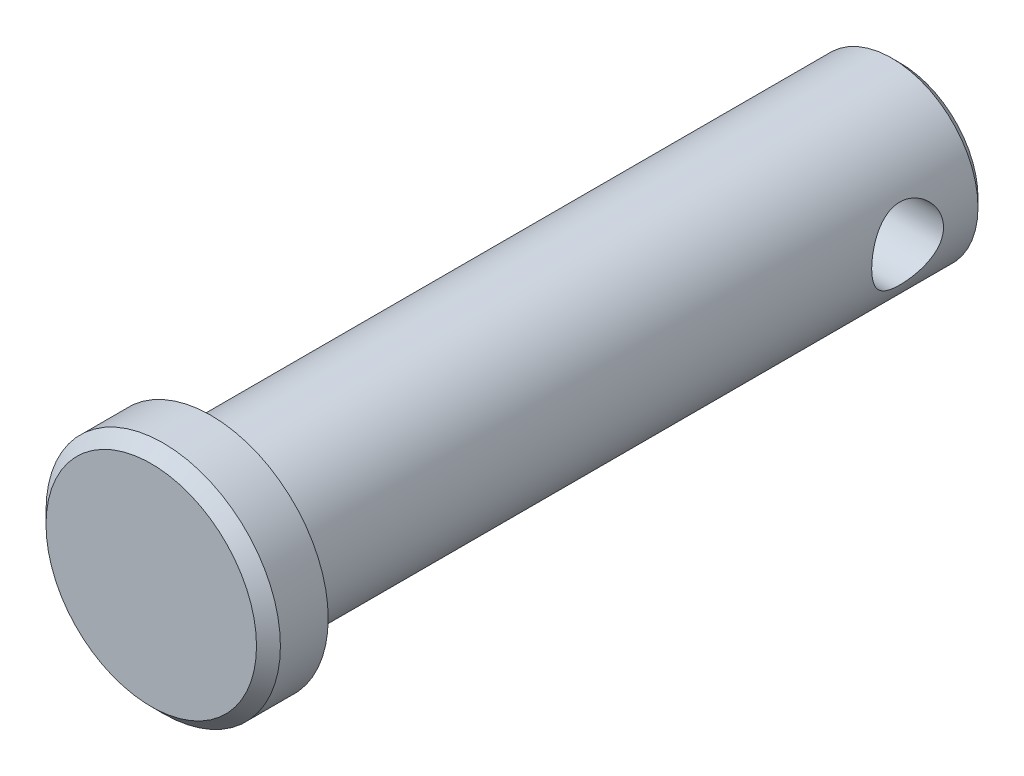
from build123d import *

# Parameters (mm, degrees)
SKETCH1_R           = 4.7625
EXTRUDE1_DEPTH      = 19.05
SKETCH2_R           = 6.477
EXTRUDE2_DEPTH      = 3.302
CHAMFER1_SIZE       = 0.6604
EXTRUDE3_DEPTH      = 25.156054355
EXTRUDE3_DEPTH_BACK = 25.156054355
SKETCH3_R           = 1.984375
CHAMFER2_SIZE       = 0.47625


with BuildPart() as part:
    # Sketch1 → Extrude1 (new, symmetric)
    with BuildSketch(Plane.XY):
        with Locations(Location((0, 0, 0), (0, 0, 180))):
            Circle(SKETCH1_R)
    extrude(amount=EXTRUDE1_DEPTH, both=True)

    # Sketch2 → Extrude2 (add)
    with BuildSketch(Plane.XY.offset(19.05)):
        with Locations(Location((0, 0, 0), (0, 0, 180))):
            Circle(SKETCH2_R)
    extrude(amount=EXTRUDE2_DEPTH)

    # Chamfer1
    chamfer1_edges = [part.edges().sort_by_distance(p)[0] for p in [
        (6.477, 0, 22.352),
    ]]
    chamfer(chamfer1_edges, length=CHAMFER1_SIZE)

    # Sketch3 → Extrude3 (cut, two sides: drawn at the far end of the back side and taken through both)
    with BuildSketch(Plane(origin=(0, 0, 0), x_dir=(0, 0, -1), z_dir=(1, 0, 0)).offset(-EXTRUDE3_DEPTH_BACK)):
        with Locations(Location((14.684375, 0, 0), (0, 0, 180.000000002))):
            Circle(SKETCH3_R)
    extrude(amount=EXTRUDE3_DEPTH + EXTRUDE3_DEPTH_BACK, mode=Mode.SUBTRACT)

    # Chamfer2
    chamfer2_edges = [part.edges().sort_by_distance(p)[0] for p in [
        (4.7625, 0, -19.05),
    ]]
    chamfer(chamfer2_edges, length=CHAMFER2_SIZE)


solid = part.part
